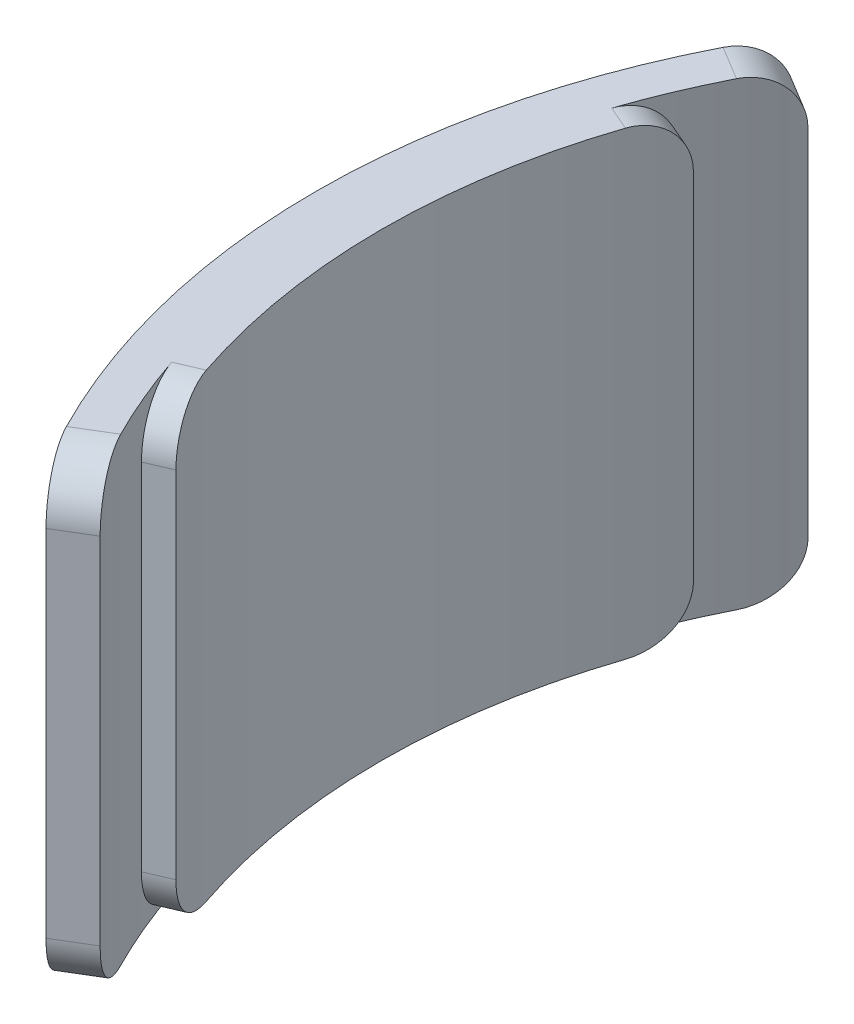
from build123d import *

# Parameters (mm, degrees)
BOSS_EXTRUDE1_DEPTH = 35
FILLET1_R           = 4
FILLET2_R           = 4


with BuildPart() as part:
    # Sketch1 → Boss-Extrude1 (new body)
    with BuildSketch(Plane(origin=(0, 0, 0), x_dir=(1, 0, 0), z_dir=(0, 1, 0))):
        with BuildLine():
            Line((-45.961922075, 19.685063351), (-47.800398958, 20.472465885))
            ThreePointArc((-47.800398958, 20.472465885), (-46.25587256, 23.756983262), (-44.4859922, 26.925759005))
            Line((-44.4859922, 26.925759005), (-47.05249175, 28.479168178))
            ThreePointArc((-47.05249175, 28.479168178), (-55, 0), (-47.05249175, -28.479168178))
            Line((-47.05249175, -28.479168178), (-44.4859922, -26.925759005))
            ThreePointArc((-44.4859922, -26.925759005), (-46.25587256, -23.756983262), (-47.800398958, -20.472465885))
            Line((-47.800398958, -20.472465885), (-45.961922075, -19.685063351))
            ThreePointArc((-45.961922075, -19.685063351), (-50, 0), (-45.961922075, 19.685063351))
        make_face()
    extrude(amount=BOSS_EXTRUDE1_DEPTH)

    # Fillet1
    fillet1_edges = [part.edges().sort_by_distance(p)[0] for p in [
        (-46.881160517, 0, -20.078764618),
        (-46.881160517, 0, 20.078764618),
        (-46.881160517, 35, 20.078764618),
        (-46.881160517, 35, -20.078764618),
    ]]
    fillet(fillet1_edges, radius=FILLET1_R)

    # Fillet2
    fillet2_edges = [part.edges().sort_by_distance(p)[0] for p in [
        (-45.769241975, 0, 27.702463591),
        (-45.769241975, 0, -27.702463591),
        (-45.769241975, 35, 27.702463591),
        (-45.769241975, 35, -27.702463591),
    ]]
    fillet(fillet2_edges, radius=FILLET2_R)


solid = part.part
